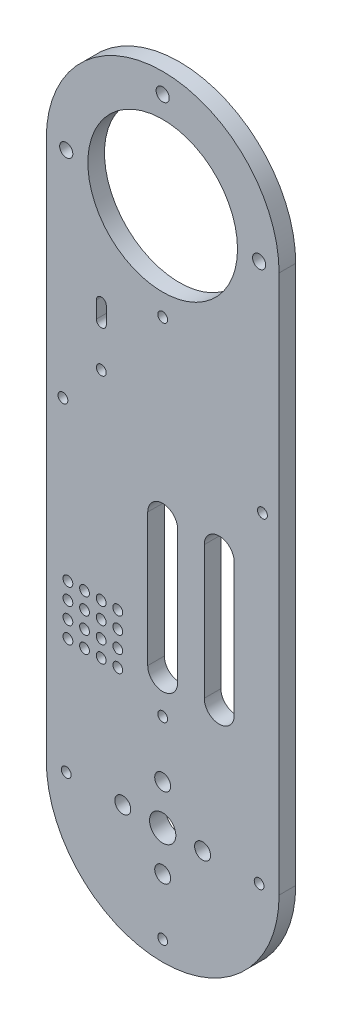
from build123d import *

# Parameters (mm, degrees)
SKETCH1_R           = 3.95
SKETCH1_R_2         = 1.475
SKETCH1_R_3         = 22.5
SKETCH1_R_4         = 2.4
SKETCH1_R_5         = 1.975
BOSS_EXTRUDE1_DEPTH = 5


with BuildPart() as part:
    # Sketch1 → Boss-Extrude1 (new body)
    with BuildSketch(Plane.XY):
        with BuildLine():
            Line((35, 0), (35, 162))
            ThreePointArc((35, 162), (0, 197), (-35, 162))
            Line((-35, 162), (-35, 0))
            ThreePointArc((-35, 0), (0, -35), (35, 0))
        make_face()
        Circle(SKETCH1_R, mode=Mode.SUBTRACT)
        with Locations((0, 29)):
            Circle(SKETCH1_R_2, mode=Mode.SUBTRACT)
        with Locations((0, 162)):
            Circle(SKETCH1_R_3, mode=Mode.SUBTRACT)
        with Locations((0, 133)):
            Circle(SKETCH1_R_2, mode=Mode.SUBTRACT)
        with Locations((-30, 97)):
            Circle(SKETCH1_R_2, mode=Mode.SUBTRACT)
        with Locations(Location((30, 97, 0), (0, 0, 180))):
            Circle(SKETCH1_R_2, mode=Mode.SUBTRACT)
        with Locations((29, 0)):
            Circle(SKETCH1_R_2, mode=Mode.SUBTRACT)
        with Locations((0, -29)):
            Circle(SKETCH1_R_2, mode=Mode.SUBTRACT)
        with Locations((-29, 0)):
            Circle(SKETCH1_R_2, mode=Mode.SUBTRACT)
        with Locations((0, 12)):
            Circle(SKETCH1_R_4, mode=Mode.SUBTRACT)
        with Locations((12, 0)):
            Circle(SKETCH1_R_4, mode=Mode.SUBTRACT)
        with Locations((0, -12)):
            Circle(SKETCH1_R_4, mode=Mode.SUBTRACT)
        with Locations((-12, 0)):
            Circle(SKETCH1_R_4, mode=Mode.SUBTRACT)
        with Locations((0, 191)):
            Circle(SKETCH1_R_5, mode=Mode.SUBTRACT)
        with Locations((29, 162)):
            Circle(SKETCH1_R_5, mode=Mode.SUBTRACT)
        with Locations((-29, 162)):
            Circle(SKETCH1_R_5, mode=Mode.SUBTRACT)
        with Locations((-18.45, 110)):
            Circle(SKETCH1_R_2, mode=Mode.SUBTRACT)
        with Locations((-28.5, 35)):
            Circle(SKETCH1_R_2, mode=Mode.SUBTRACT)
        with Locations((-23.5, 35)):
            Circle(SKETCH1_R_2, mode=Mode.SUBTRACT)
        with Locations((-18.5, 35)):
            Circle(SKETCH1_R_2, mode=Mode.SUBTRACT)
        with Locations((-13.5, 35)):
            Circle(SKETCH1_R_2, mode=Mode.SUBTRACT)
        with Locations((-28.5, 40)):
            Circle(SKETCH1_R_2, mode=Mode.SUBTRACT)
        with Locations((-23.5, 40)):
            Circle(SKETCH1_R_2, mode=Mode.SUBTRACT)
        with Locations((-18.5, 40)):
            Circle(SKETCH1_R_2, mode=Mode.SUBTRACT)
        with Locations((-13.5, 40)):
            Circle(SKETCH1_R_2, mode=Mode.SUBTRACT)
        with Locations((-28.5, 45)):
            Circle(SKETCH1_R_2, mode=Mode.SUBTRACT)
        with Locations((-23.5, 45)):
            Circle(SKETCH1_R_2, mode=Mode.SUBTRACT)
        with Locations((-18.5, 45)):
            Circle(SKETCH1_R_2, mode=Mode.SUBTRACT)
        with Locations((-13.5, 45)):
            Circle(SKETCH1_R_2, mode=Mode.SUBTRACT)
        with Locations((-28.5, 50)):
            Circle(SKETCH1_R_2, mode=Mode.SUBTRACT)
        with Locations((-23.5, 50)):
            Circle(SKETCH1_R_2, mode=Mode.SUBTRACT)
        with Locations((-18.5, 50)):
            Circle(SKETCH1_R_2, mode=Mode.SUBTRACT)
        with Locations((-13.5, 50)):
            Circle(SKETCH1_R_2, mode=Mode.SUBTRACT)
        with BuildLine():
            Line((4.5, 80), (4.5, 40))
            ThreePointArc((4.5, 40), (0, 35.5), (-4.5, 40))
            Line((-4.5, 40), (-4.5, 80))
            ThreePointArc((-4.5, 80), (0, 84.5), (4.5, 80))
        make_face(mode=Mode.SUBTRACT)
        with BuildLine():
            Line((21.5, 80), (21.5, 40))
            ThreePointArc((21.5, 40), (17, 35.5), (12.5, 40))
            Line((12.5, 40), (12.5, 80))
            ThreePointArc((12.5, 80), (17, 84.5), (21.5, 80))
        make_face(mode=Mode.SUBTRACT)
        with BuildLine():
            Line((-16.95, 127.5), (-16.95, 122.5))
            ThreePointArc((-16.95, 122.5), (-18.45, 121), (-19.95, 122.5))
            Line((-19.95, 122.5), (-19.95, 127.5))
            ThreePointArc((-19.95, 127.5), (-18.45, 129), (-16.95, 127.5))
        make_face(mode=Mode.SUBTRACT)
    extrude(amount=BOSS_EXTRUDE1_DEPTH)


solid = part.part
